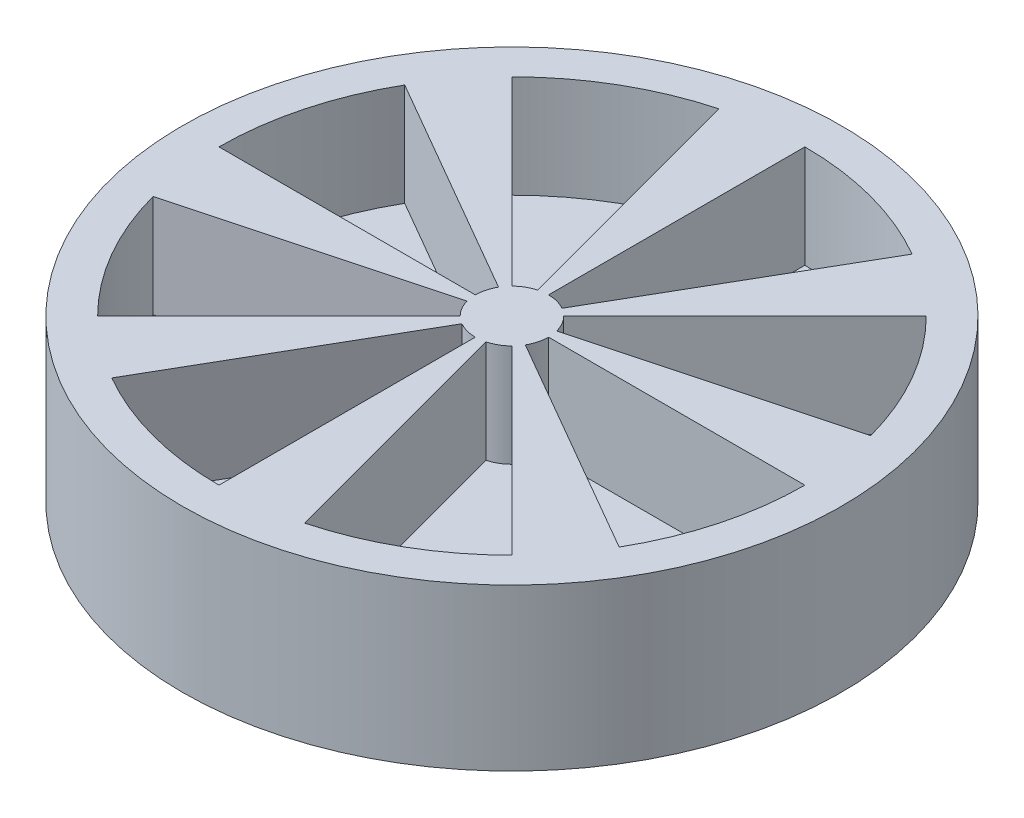
from build123d import *

# Parameters (mm, degrees)
SKETCH1_R                                     = 22.5
MAIN_EXTRUDE_FOR_PLASTIC_MECHANSIM_PART_DEPTH = 11
MAIN_CUT_FOR_PLASTIC_MECHANISM_PART_DEPTH     = 7


with BuildPart() as part:
    # Sketch1 → Main Extrude for Plastic Mechansim Part (new body)
    with BuildSketch(Plane(origin=(0, 0, 0), x_dir=(1, 0, 0), z_dir=(0, 1, 0))):
        with Locations(Location((0, 0, 0), (0, 0, 270))):
            Circle(SKETCH1_R)
    extrude(amount=MAIN_EXTRUDE_FOR_PLASTIC_MECHANSIM_PART_DEPTH)

    # Sketch2 → Main Cut for Plastic Mechanism Part (cut)
    with BuildSketch(Plane(origin=(0, 11, 0), x_dir=(1, 0, 0), z_dir=(0, 1, 0))):
        with BuildLine():
            Line((0, 20), (0, 2.5))
            ThreePointArc((0, 2.5), (0.647047613, 2.414814566), (1.25, 2.165063509))
            Line((1.25, 2.165063509), (10, 17.320508076))
            ThreePointArc((10, 17.320508076), (5.176380902, 19.318516526), (0, 20))
        make_face()
        with BuildLine():
            Line((-20, 0), (-2.5, 0))
            ThreePointArc((-2.5, 0), (-2.414814566, 0.647047613), (-2.165063509, 1.25))
            Line((-2.165063509, 1.25), (-17.320508076, 10))
            ThreePointArc((-17.320508076, 10), (-19.318516526, 5.176380902), (-20, 0))
        make_face()
        with BuildLine():
            Line((-14.142135624, -14.142135624), (-1.767766953, -1.767766953))
            ThreePointArc((-1.767766953, -1.767766953), (-2.165063509, -1.25), (-2.414814566, -0.647047613))
            Line((-2.414814566, -0.647047613), (-19.318516526, -5.176380902))
            ThreePointArc((-19.318516526, -5.176380902), (-17.320508076, -10), (-14.142135624, -14.142135624))
        make_face()
        with BuildLine():
            Line((-14.142135624, 14.142135624), (-1.767766953, 1.767766953))
            ThreePointArc((-1.767766953, 1.767766953), (-1.25, 2.165063509), (-0.647047613, 2.414814566))
            Line((-0.647047613, 2.414814566), (-5.176380902, 19.318516526))
            ThreePointArc((-5.176380902, 19.318516526), (-10, 17.320508076), (-14.142135624, 14.142135624))
        make_face()
        with BuildLine():
            Line((0, -2.5), (0, -20))
            ThreePointArc((0, -20), (-5.176380902, -19.318516526), (-10, -17.320508076))
            Line((-10, -17.320508076), (-1.25, -2.165063509))
            ThreePointArc((-1.25, -2.165063509), (-0.647047613, -2.414814566), (0, -2.5))
        make_face()
        with BuildLine():
            Line((1.767766953, 1.767766953), (14.142135624, 14.142135624))
            ThreePointArc((14.142135624, 14.142135624), (17.320508076, 10), (19.318516526, 5.176380902))
            Line((19.318516526, 5.176380902), (2.414814566, 0.647047613))
            ThreePointArc((2.414814566, 0.647047613), (2.165063509, 1.25), (1.767766953, 1.767766953))
        make_face()
        with BuildLine():
            Line((2.5, 0), (20, 0))
            ThreePointArc((20, 0), (19.318516526, -5.176380902), (17.320508076, -10))
            Line((17.320508076, -10), (2.165063509, -1.25))
            ThreePointArc((2.165063509, -1.25), (2.414814566, -0.647047613), (2.5, 0))
        make_face()
        with BuildLine():
            Line((1.767766953, -1.767766953), (14.142135624, -14.142135624))
            ThreePointArc((14.142135624, -14.142135624), (10, -17.320508076), (5.176380902, -19.318516526))
            Line((5.176380902, -19.318516526), (0.647047613, -2.414814566))
            ThreePointArc((0.647047613, -2.414814566), (1.25, -2.165063509), (1.767766953, -1.767766953))
        make_face()
    extrude(amount=-MAIN_CUT_FOR_PLASTIC_MECHANISM_PART_DEPTH, mode=Mode.SUBTRACT)


solid = part.part
